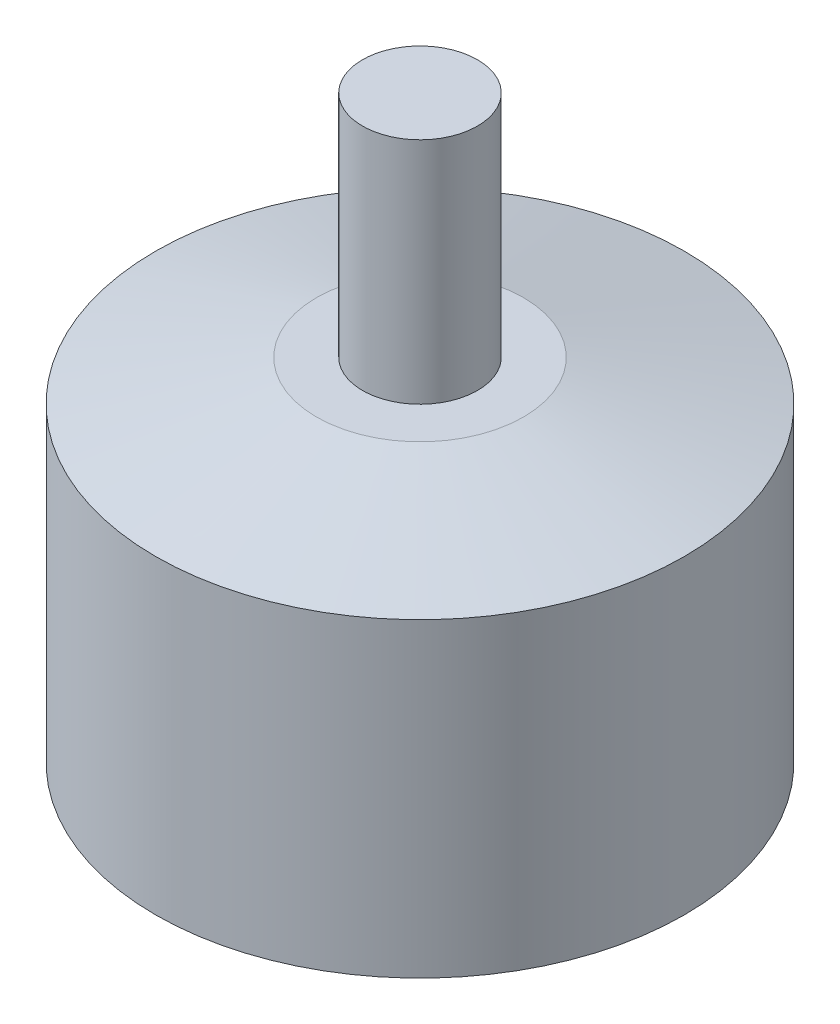
from build123d import *

# Parameters (mm, degrees)
SKETCH2_W   = 2.5
SKETCH2_H   = 9.960613413
SKETCH2_W_2 = 11.5
SKETCH2_H_2 = 13.5


with BuildPart() as part:
    # Sketch2 → Revolve1 (revolve)
    with BuildSketch(Plane.XY, mode=Mode.PRIVATE) as revolve1_sk:
        Polygon((-4.5, 15.25), (-11.5, 13.5), (-4.5, 13.5), align=None)
        Polygon((-2.5, 15.25), (-4.5, 15.25), (-4.5, 13.5), (0, 13.5), (0, 15.25), align=None)
        with Locations((-1.25, 20.230306707)):
            Rectangle(SKETCH2_W, SKETCH2_H)
        with Locations((-5.75, 6.75)):
            Rectangle(SKETCH2_W_2, SKETCH2_H_2)
    revolve(revolve1_sk.sketch.rotate(Axis((0, 15.25, 0), (0, 1, 0)), 270), axis=Axis((0, 15.25, 0), (0, 1, 0)))


solid = part.part
